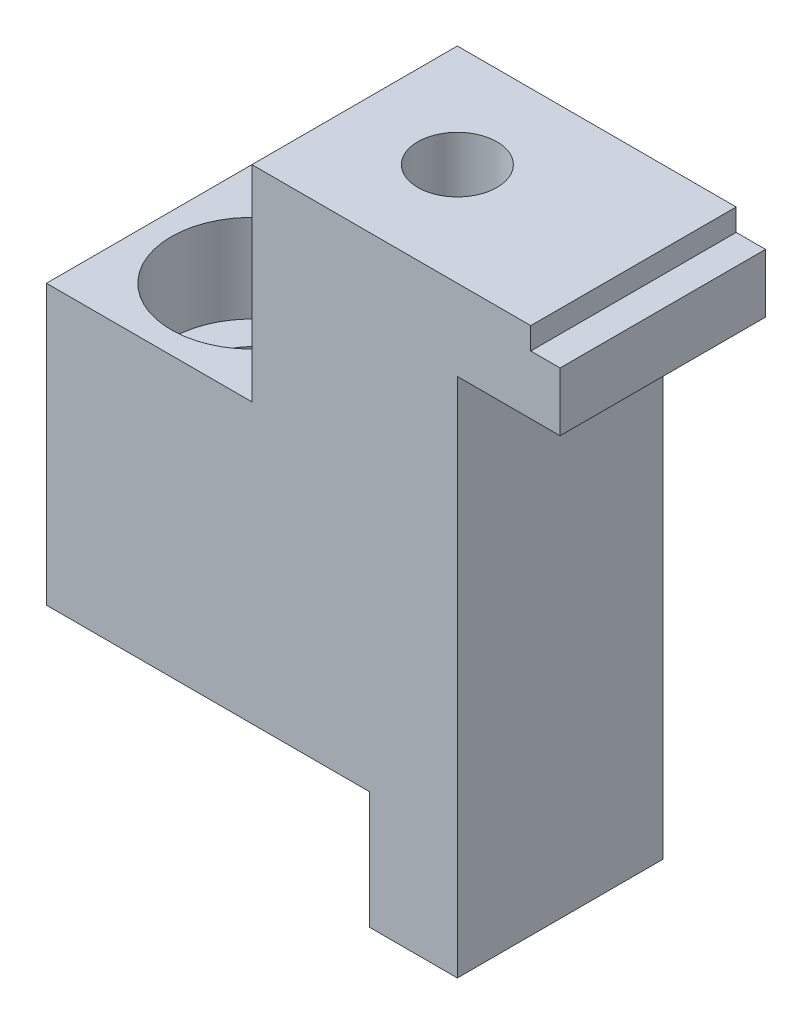
from build123d import *

# Parameters (mm, degrees)
SALIENTE_EXTRUIR1_DEPTH = 7
CROQUIS4_R              = 1.35
CORTAR_EXTRUIR1_DEPTH   = 13.5
CROQUIS5_R              = 1.6
CORTAR_EXTRUIR2_DEPTH   = 13.9
CROQUIS6_R              = 2.75
CORTAR_EXTRUIR3_DEPTH   = 3


with BuildPart() as part:
    # Croquis1 → Saliente-Extruir1 (new body)
    with BuildSketch(Plane.XY):
        Polygon((0, 0), (4, 0), (4, -4), (7, -4), (7, 0), (7, 13.75), (10.5, 13.75), (10.5, 15.75), (9.5, 15.75), (9.5, 16.5), (7, 16.5), (0, 16.5), (0, 9.5), (-7, 9.5), (-7, 0), align=None)
    extrude(amount=SALIENTE_EXTRUIR1_DEPTH)

    # Croquis4 → Cortar-Extruir1 (cut)
    with BuildSketch(Plane(origin=(0, 16.5, 0), x_dir=(1, 0, 0), z_dir=(0, 1, 0))):
        with Locations(Location((3.5, -3.5, 0), (0, 0, 270))):
            Circle(CROQUIS4_R)
    extrude(amount=-CORTAR_EXTRUIR1_DEPTH, mode=Mode.SUBTRACT)

    # Croquis5 → Cortar-Extruir2 (cut)
    with BuildSketch(Plane(origin=(0, 9.5, 0), x_dir=(1, 0, 0), z_dir=(0, 1, 0))):
        with Locations(Location((-3.5, -3.5, 0), (0, 0, 180))):
            Circle(CROQUIS5_R)
    extrude(amount=-CORTAR_EXTRUIR2_DEPTH, mode=Mode.SUBTRACT)

    # Croquis6 → Cortar-Extruir3 (cut)
    with BuildSketch(Plane(origin=(0, 9.5, 0), x_dir=(1, 0, 0), z_dir=(0, 1, 0))):
        with Locations(Location((-3.5, -3.5, 0), (0, 0, 180))):
            Circle(CROQUIS6_R)
    extrude(amount=-CORTAR_EXTRUIR3_DEPTH, mode=Mode.SUBTRACT)


solid = part.part
